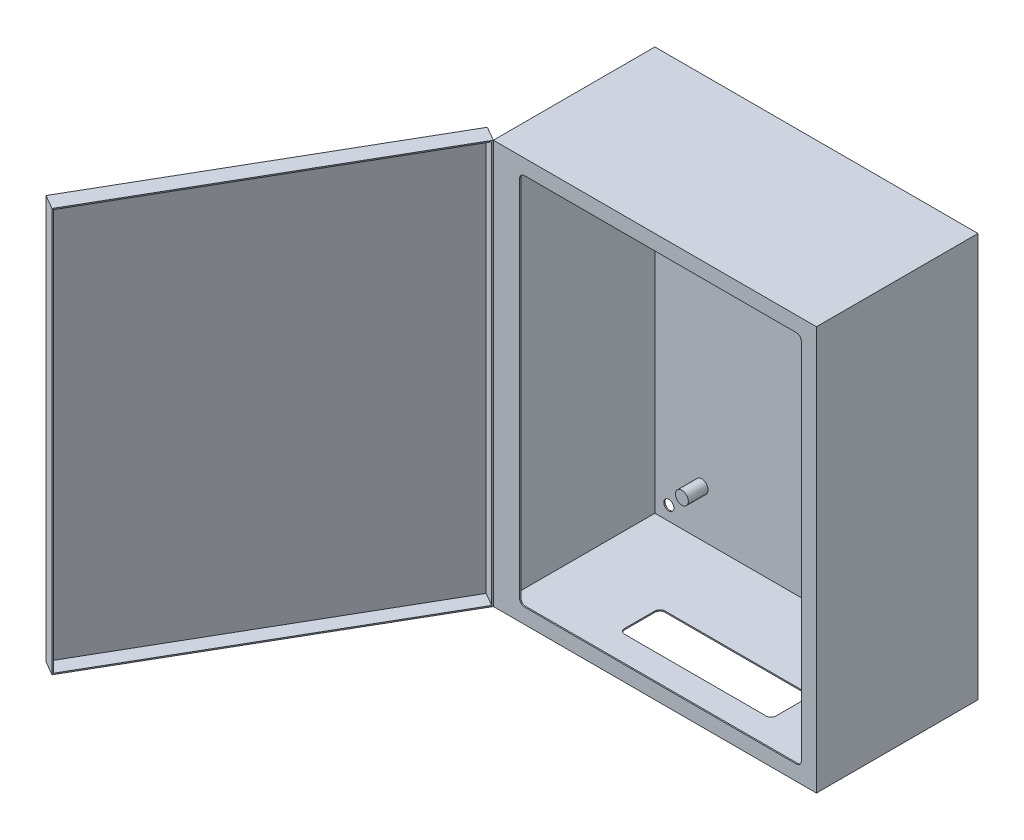
from build123d import *

# Parameters (mm, degrees)
SKETCH1_W                = 406.4
SKETCH1_H                = 508
EXTRUDE1_DEPTH           = 203.2
SHELL1_T                 = -1.524
SKETCH2_R                = 6.35
CUT_EXTRUDE1_DEPTH       = 384.531589312
SKETCH6_W                = 406.4
SKETCH6_H                = 508
EXTRUDE3_DEPTH           = 1.524
SKETCH4_W                = 406.4
SKETCH4_H                = 508
EXTRUDE2_DEPTH           = 20.6375
SHELL2_T                 = -1.524
SKETCH7_R                = 13.49375
CUT_EXTRUDE2_DEPTH       = 2.54
SKETCH9_R                = 15.875
EXTRUDE5_DEPTH           = 3.175
EXTRUDE5_DRAFT           = 10
EXTRUDE5_PROFILE_2_DEPTH = 3.175
EXTRUDE5_PROFILE_2_DRAFT = 10
SKETCH10_W               = 391.049820908
SKETCH10_H               = 0.762
CUT_EXTRUDE3_DEPTH       = 1.524
SKETCH11_R               = 8.128
EXTRUDE6_DEPTH           = 26.416
SKETCH12_R               = 31.75
CUT_EXTRUDE5_DEPTH       = 2.54
CUT_EXTRUDE6_DEPTH       = 12.7


with BuildPart() as part:
    # Sketch1 → Extrude1 (new body)
    with BuildSketch(Plane.XY):
        Rectangle(SKETCH1_W, SKETCH1_H)
    extrude(amount=EXTRUDE1_DEPTH)

    # Shell1
    shell1_openings = [part.faces().sort_by_distance(p)[0] for p in [
        (0, 0, 203.2),
    ]]
    offset(amount=SHELL1_T, openings=shell1_openings, kind=Kind.INTERSECTION)

    # Sketch2 → Cut-Extrude1 (cut, through all)
    with BuildSketch(Plane.XY):
        with Locations((184.15, -234.95)):
            Circle(SKETCH2_R)
        with Locations(Location((-184.15, -234.95, 0), (0, 0, 180))):
            Circle(SKETCH2_R)
        with Locations(Location((184.15, 234.95, 0), (0, 0, 180))):
            Circle(SKETCH2_R)
        with Locations((-184.15, 234.95)):
            Circle(SKETCH2_R)
    extrude(amount=CUT_EXTRUDE1_DEPTH, mode=Mode.SUBTRACT)

    # Sketch6 → Extrude3 (add)
    with BuildSketch(Plane.XY.offset(203.2)):
        Rectangle(SKETCH6_W, SKETCH6_H)
        with BuildLine():
            Line((-163.83, 234.95), (177.8, 234.95))
            ThreePointArc((177.8, 234.95), (182.290128061, 233.090128061), (184.15, 228.6))
            Line((184.15, 228.6), (184.15, -228.6))
            ThreePointArc((184.15, -228.6), (182.290128061, -233.090128061), (177.8, -234.95))
            Line((177.8, -234.95), (-163.83, -234.95))
            ThreePointArc((-163.83, -234.95), (-168.320128061, -233.090128061), (-170.18, -228.6))
            Line((-170.18, -228.6), (-170.18, 228.6))
            ThreePointArc((-170.18, 228.6), (-168.320128061, 233.090128061), (-163.83, 234.95))
        make_face(mode=Mode.SUBTRACT)
    extrude(amount=-EXTRUDE3_DEPTH)

    # Sketch7 → Cut-Extrude2 (cut)
    with BuildSketch(Plane.ZY.offset(203.2)):
        with Locations((60.325, 184.15)):
            Circle(SKETCH7_R)
    extrude(amount=-CUT_EXTRUDE2_DEPTH, mode=Mode.SUBTRACT)

    # Sketch11 → Extrude6 (add)
    with BuildSketch(Plane.XY):
        with Locations(Location((142.875, 193.675, 0), (0, 0, 180))):
            Circle(SKETCH11_R)
        with Locations(Location((-142.875, 193.675, 0), (0, 0, 180))):
            Circle(SKETCH11_R)
        with Locations(Location((142.875, -193.675, 0), (0, 0, 180))):
            Circle(SKETCH11_R)
        with Locations(Location((-142.875, -193.675, 0), (0, 0, 180))):
            Circle(SKETCH11_R)
    extrude(amount=EXTRUDE6_DEPTH)

    # Sketch12 → Cut-Extrude5 (cut)
    with BuildSketch(Plane.XY):
        with Locations((101.6, 0)):
            Circle(SKETCH12_R)
        with Locations((101.6, -127)):
            Circle(SKETCH12_R)
        with Locations((101.6, 127)):
            Circle(SKETCH12_R)
    extrude(amount=CUT_EXTRUDE5_DEPTH, mode=Mode.SUBTRACT)

    # Sketch14 → Cut-Extrude6 (cut)
    with BuildSketch(Plane.XZ.offset(254)):
        with BuildLine():
            Line((-88.9, 152.4), (88.9, 152.4))
            ThreePointArc((88.9, 152.4), (93.390128061, 150.540128061), (95.25, 146.05))
            Line((95.25, 146.05), (95.25, 107.95))
            ThreePointArc((95.25, 107.95), (93.390128061, 103.459871939), (88.9, 101.6))
            Line((88.9, 101.6), (-88.9, 101.6))
            ThreePointArc((-88.9, 101.6), (-93.390128061, 103.459871939), (-95.25, 107.95))
            Line((-95.25, 107.95), (-95.25, 146.05))
            ThreePointArc((-95.25, 146.05), (-93.390128061, 150.540128061), (-88.9, 152.4))
        make_face()
    extrude(amount=-CUT_EXTRUDE6_DEPTH, mode=Mode.SUBTRACT)


with BuildPart() as body_2:
    # Sketch4 → Extrude2 (new body)
    with BuildSketch(Plane(origin=(-287.262584572, 0, 348.800667495), x_dir=(0.4999999999999948, 0, -0.8660254037844417), z_dir=(0.8660254037844417, 0, 0.4999999999999948))):
        with Locations((-35.074830855, 0)):
            Rectangle(SKETCH4_W, SKETCH4_H)
    extrude(amount=-EXTRUDE2_DEPTH)

    # Shell2
    shell2_openings = [body_2.faces().sort_by_distance(p)[0] for p in [
        (-304.8, 0, 379.176362049),
    ]]
    offset(amount=SHELL2_T, openings=shell2_openings, kind=Kind.INTERSECTION)


with BuildPart() as extrude5_tool:
    # Sketch9 → Extrude5 (with draft: the straight prism first)
    with BuildSketch(Plane(origin=(-82.284418246, 0, -47.506931024), x_dir=(-0.49999999999999467, 0, 0.8660254037844417), z_dir=(-0.8660254037844417, 0, -0.49999999999999467))):
        with Locations((633.176362049, 163.5125)):
            Circle(SKETCH9_R)
    extrude(amount=EXTRUDE5_DEPTH)
    # Extrude5: the draft: its side faces are tilted about the plane it starts from
    extrude5_sides = [extrude5_tool.faces().sort_by_distance(p)[0] for p in [
        (-392.309914599, 163.5125, 486.297980301),
    ]]
    draft(extrude5_sides, Plane(origin=(-82.284418246, 0, -47.506931024), x_dir=(-0.49999999999999467, 0, 0.8660254037844417), z_dir=(-0.8660254037844417, 0, -0.49999999999999467)), EXTRUDE5_DRAFT)


with BuildPart() as body_2_1:
    add(body_2.part)

    # Extrude5: add extrude5_tool
    add(extrude5_tool.part)


with BuildPart() as extrude5_profile_2_tool:
    # Sketch9 → Extrude5 profile 2 (with draft: the straight prism first)
    with BuildSketch(Plane(origin=(-82.284418246, 0, -47.506931024), x_dir=(-0.49999999999999467, 0, 0.8660254037844417), z_dir=(-0.8660254037844417, 0, -0.49999999999999467))):
        with Locations((633.176362049, -163.5125)):
            Circle(SKETCH9_R)
    extrude(amount=EXTRUDE5_PROFILE_2_DEPTH)
    # Extrude5 profile 2: the draft: its side faces are tilted about the plane it starts from
    extrude5_profile_2_sides = [extrude5_profile_2_tool.faces().sort_by_distance(p)[0] for p in [
        (-392.309914599, -163.5125, 486.297980301),
    ]]
    draft(extrude5_profile_2_sides, Plane(origin=(-82.284418246, 0, -47.506931024), x_dir=(-0.49999999999999467, 0, 0.8660254037844417), z_dir=(-0.8660254037844417, 0, -0.49999999999999467)), EXTRUDE5_PROFILE_2_DRAFT)


with BuildPart() as body_2_2:
    add(body_2_1.part)

    # Extrude5 profile 2: add extrude5_profile_2_tool
    add(extrude5_profile_2_tool.part)

    # Sketch10 → Cut-Extrude3 (cut)
    with BuildSketch(Plane(origin=(-85.034048903, 0, -49.094431024), x_dir=(-0.4999999999999946, 0, 0.8660254037844417), z_dir=(-0.8660254037844417, 0, -0.4999999999999946))):
        with Locations((633.176362049, -163.5125)):
            Rectangle(SKETCH10_W, SKETCH10_H)
        with Locations((633.176362049, 163.5125)):
            Rectangle(SKETCH10_W, SKETCH10_H)
    extrude(amount=-CUT_EXTRUDE3_DEPTH, mode=Mode.SUBTRACT)


solid = Compound([part.part, body_2_2.part])
